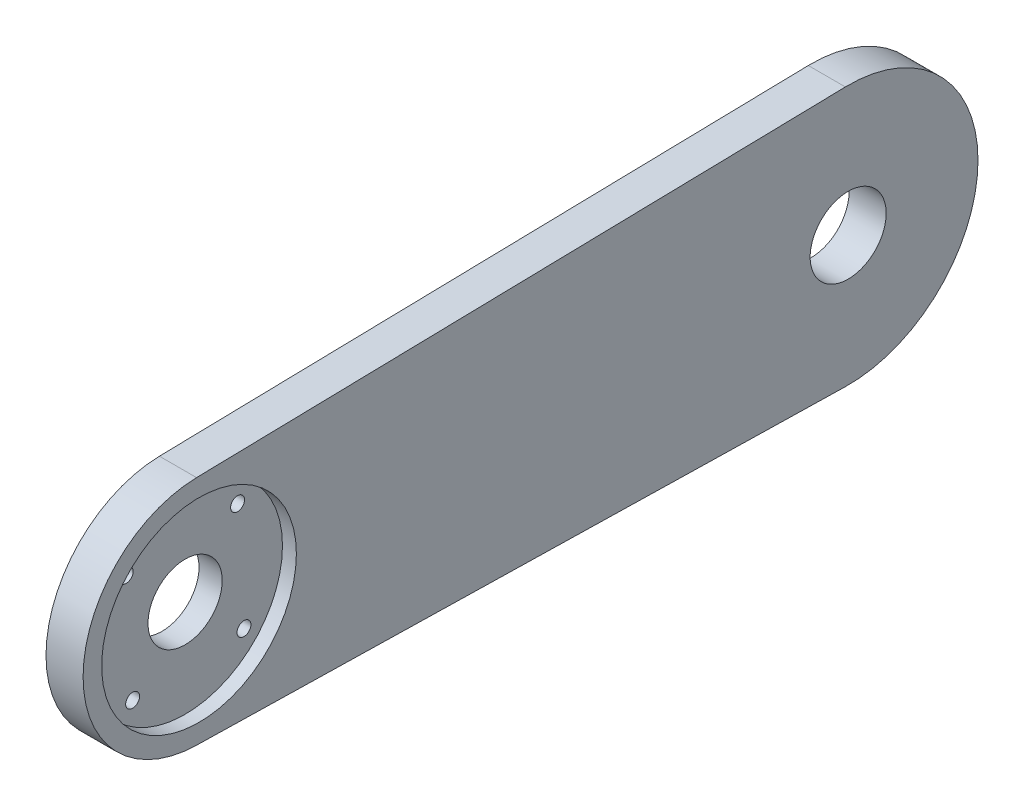
from build123d import *

# Parameters (mm, degrees)
CROQUIS1_R              = 4.1
CROQUIS1_R_2            = 4
SALIENTE_EXTRUIR1_DEPTH = 4
CROQUIS2_R              = 10.5
CORTAR_EXTRUIR1_DEPTH   = 1.5
CROQUIS3_R              = 0.75
CORTAR_EXTRUIR2_DEPTH   = 10


with BuildPart() as part:
    # Croquis1 → Saliente-Extruir1 (new body)
    with BuildSketch(Plane(origin=(0, 0, 0), x_dir=(0, 0, -1), z_dir=(1, 0, 0))):
        with BuildLine():
            Line((-70.267857143, 12.497129773), (-0.3, 13.996785345))
            ThreePointArc((-0.3, 13.996785345), (14, 0), (-0.3, -13.996785345))
            Line((-0.3, -13.996785345), (-70.267857143, -12.497129773))
            ThreePointArc((-70.267857143, -12.497129773), (-82.5, 0), (-70.267857143, 12.497129773))
        make_face()
        Circle(CROQUIS1_R, mode=Mode.SUBTRACT)
        with Locations((-70, 0)):
            Circle(CROQUIS1_R_2, mode=Mode.SUBTRACT)
    extrude(amount=SALIENTE_EXTRUIR1_DEPTH)

    # Croquis2 → Cortar-Extruir1 (cut)
    with BuildSketch(Plane(origin=(4, 0, 0), x_dir=(0, 0, -1), z_dir=(1, 0, 0))):
        with Locations((-70, 0)):
            Circle(CROQUIS2_R)
    extrude(amount=-CORTAR_EXTRUIR1_DEPTH, mode=Mode.SUBTRACT)

    # Croquis3 → Cortar-Extruir2 (cut)
    with BuildSketch(Plane.ZY):
        with Locations((63.65189161, -5.658093307)):
            Circle(CROQUIS3_R)
        with Locations((76.34810839, 5.658093307)):
            Circle(CROQUIS3_R)
        with Locations((64.341906693, 6.34810839)):
            Circle(CROQUIS3_R)
        with Locations((75.658093307, -6.34810839)):
            Circle(CROQUIS3_R)
    extrude(amount=-CORTAR_EXTRUIR2_DEPTH, mode=Mode.SUBTRACT)


solid = part.part
